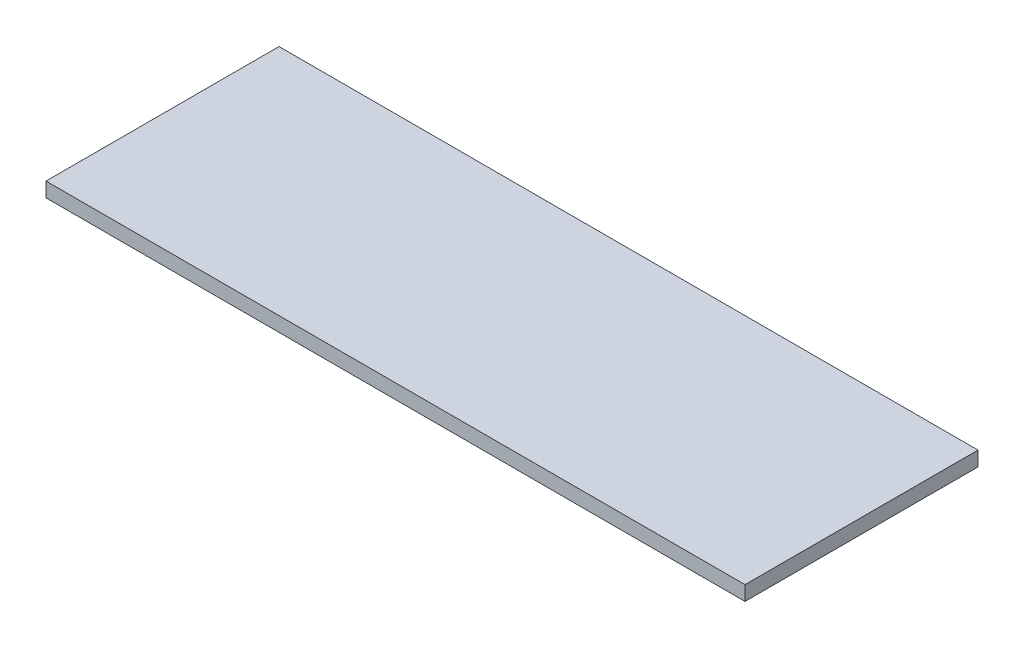
from build123d import *

# Parameters (mm, degrees)
SKETCH1_W             = 48
SKETCH1_H             = 16
BOSS_EXTRUDE1_DEPTH   = 1
BODY_MOVE_COPY1_ANGLE = 90


with BuildPart() as part:
    # Sketch1 → Boss-Extrude1 (new body)
    with BuildSketch(Plane.XY):
        with Locations((43.688888889, 8.105555556)):
            Rectangle(SKETCH1_W, SKETCH1_H)
    extrude(amount=BOSS_EXTRUDE1_DEPTH)


with BuildPart() as part_1:
    # Body-Move/Copy1: moved
    add(part.part.rotate(Axis((0, 8.105555556, 0.25), (1, 0, 0)), BODY_MOVE_COPY1_ANGLE))


solid = part_1.part
